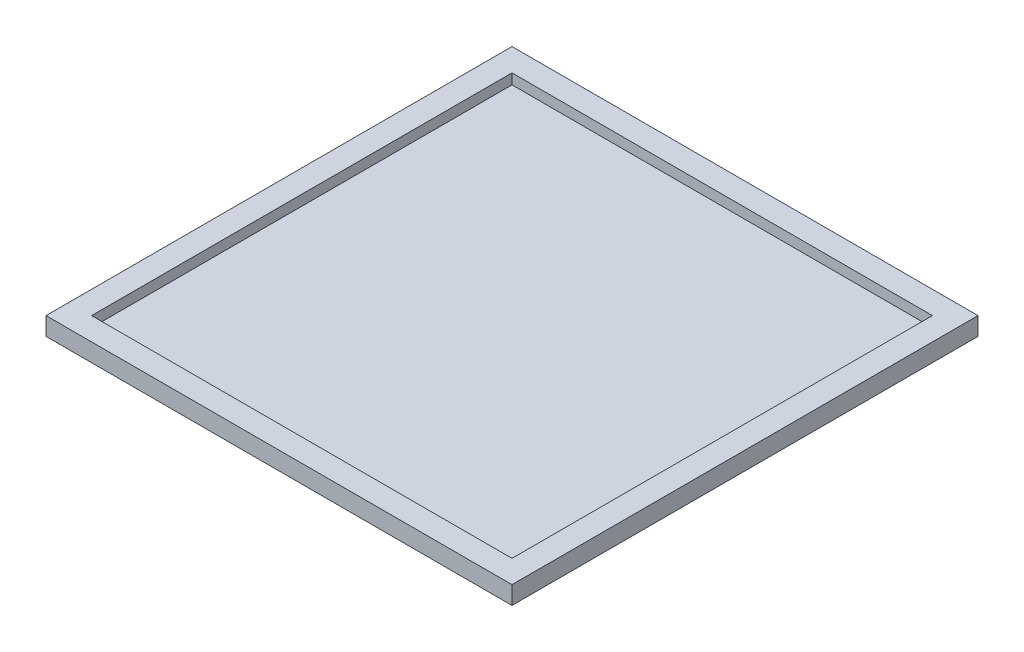
from build123d import *

# Parameters (mm, degrees)
SKETCH1_W           = 820
SKETCH1_H           = 820
BOSS_EXTRUDE1_DEPTH = 31.7
SKETCH2_W           = 739.8
SKETCH2_H           = 739.8
CUT_EXTRUDE1_DEPTH  = 18.31


with BuildPart() as part:
    # Sketch1 → Boss-Extrude1 (new body)
    with BuildSketch(Plane(origin=(0, 0, 0), x_dir=(1, 0, 0), z_dir=(0, 1, 0))):
        with Locations((84.389101173, -37.943808122)):
            Rectangle(SKETCH1_W, SKETCH1_H)
    extrude(amount=BOSS_EXTRUDE1_DEPTH)

    # Sketch2 → Cut-Extrude1 (cut)
    with BuildSketch(Plane(origin=(0, 31.7, 0), x_dir=(1, 0, 0), z_dir=(0, 1, 0))):
        with Locations((84.389101173, -37.943808122)):
            Rectangle(SKETCH2_W, SKETCH2_H)
    extrude(amount=-CUT_EXTRUDE1_DEPTH, mode=Mode.SUBTRACT)


solid = part.part
